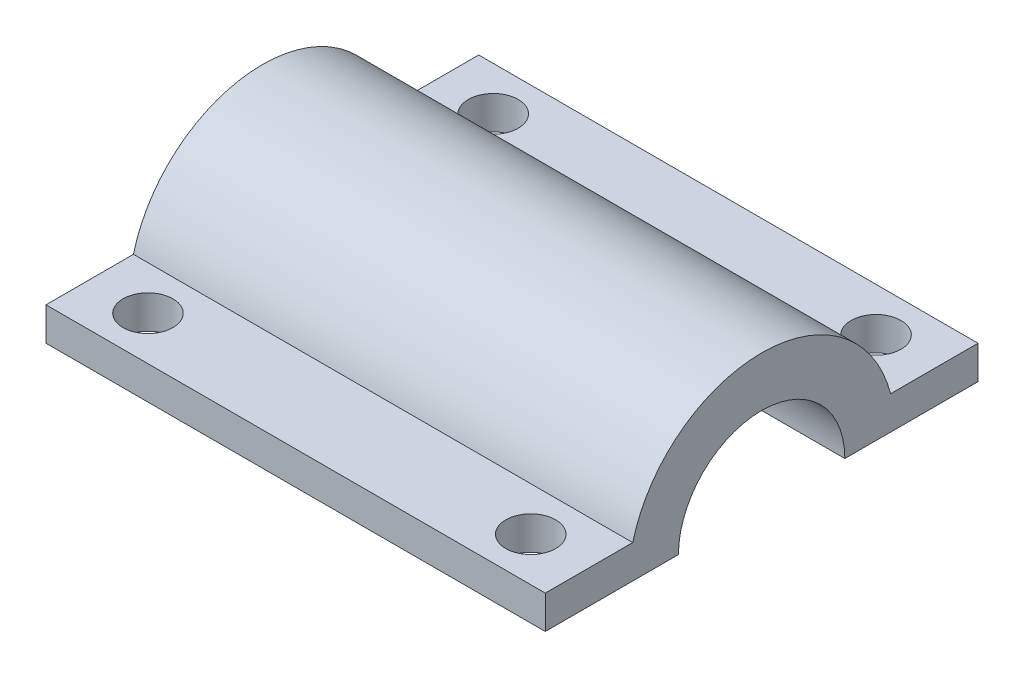
from build123d import *

# Parameters (mm, degrees)
EXTRUDE_1_DEPTH     = 30
SKETCH_2_R          = 1.5
CUT_EXTRUDE_1_DEPTH = 10


with BuildPart() as part:
    # 草图1 → 凸台-拉伸1 (new body)
    with BuildSketch(Plane(origin=(0, 0, 0), x_dir=(0, 0, -1), z_dir=(1, 0, 0))):
        with BuildLine():
            Line((-5, 0), (-13, 0))
            Line((-13, 0), (-13, 2))
            Line((-13, 2), (-7.745966692, 2))
            ThreePointArc((-7.745966692, 2), (0, 8), (7.745966692, 2))
            Line((7.745966692, 2), (13, 2))
            Line((13, 2), (13, 0))
            Line((13, 0), (5, 0))
            ThreePointArc((5, 0), (0, 5), (-5, 0))
        make_face()
    extrude(amount=EXTRUDE_1_DEPTH)

    # 草图2 → 切除-拉伸1 (cut)
    with BuildSketch(Plane.XZ):
        with Locations(Location((26.5, -10.372983346, 0), (0, 0, 270))):
            Circle(SKETCH_2_R)
        with Locations(Location((3.5, -10.372983346, 0), (0, 0, 270))):
            Circle(SKETCH_2_R)
        with Locations(Location((3.5, 10.372983346, 0), (0, 0, 270))):
            Circle(SKETCH_2_R)
        with Locations(Location((26.5, 10.372983346, 0), (0, 0, 270))):
            Circle(SKETCH_2_R)
    extrude(amount=-CUT_EXTRUDE_1_DEPTH, mode=Mode.SUBTRACT)


solid = part.part
